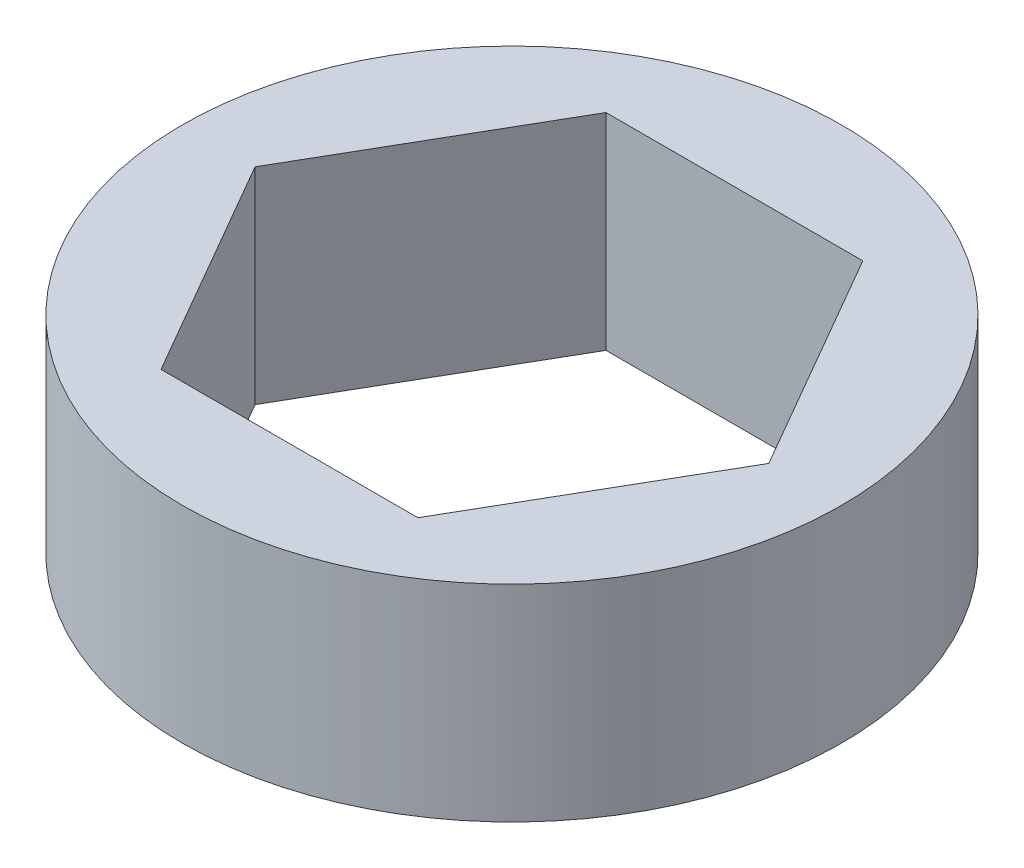
from build123d import *

# Parameters (mm, degrees)
SKETCH1_R           = 10.16
BOSS_EXTRUDE1_DEPTH = 6.35


with BuildPart() as part:
    # Sketch1 → Boss-Extrude1 (new body)
    with BuildSketch(Plane(origin=(0, 0, 0), x_dir=(1, 0, 0), z_dir=(0, 1, 0))):
        with Locations(Location((0, 0, 0), (0, 0, 270))):
            Circle(SKETCH1_R)
        Polygon((7.918936292, 0), (3.959468146, 6.858), (-3.959468146, 6.858), (-7.918936292, 0), (-3.959468146, -6.858), (3.959468146, -6.858), align=None, mode=Mode.SUBTRACT)
    extrude(amount=BOSS_EXTRUDE1_DEPTH)


solid = part.part
